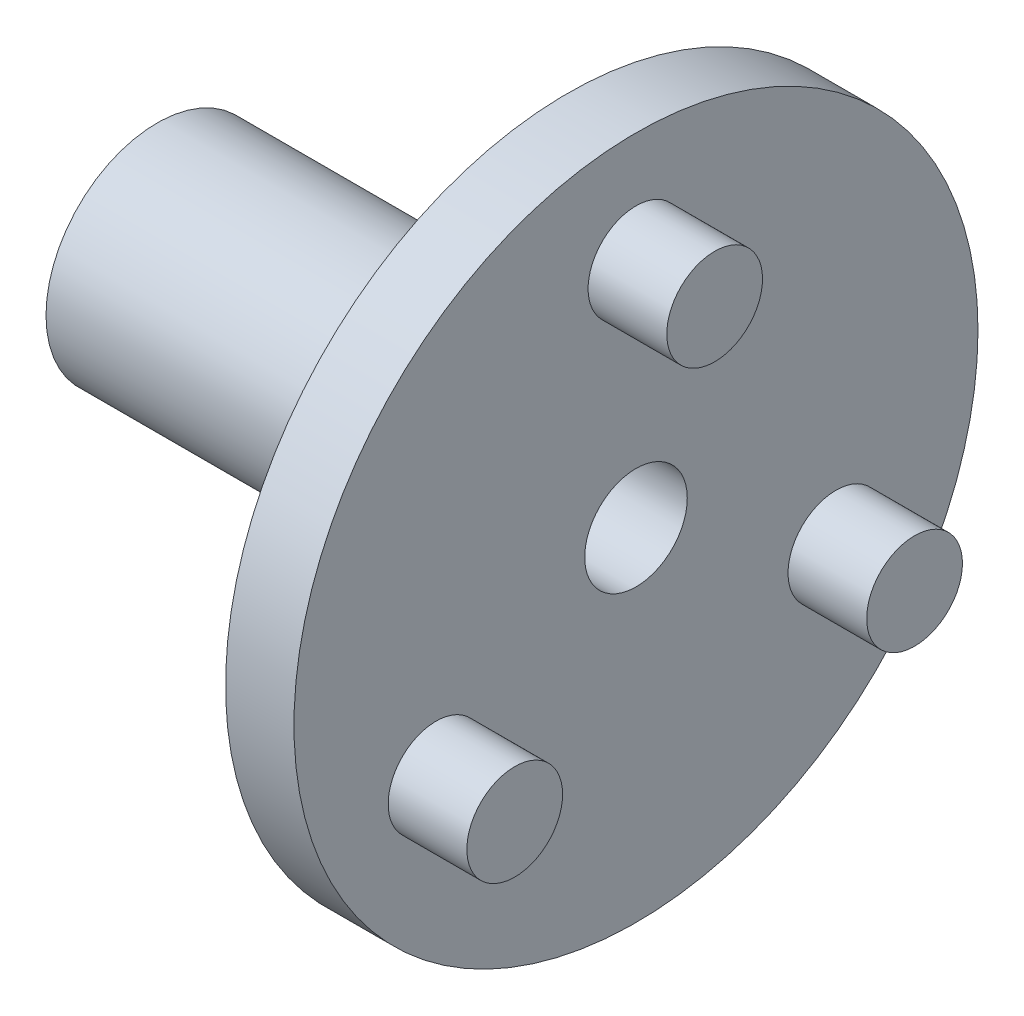
from build123d import *

# Parameters (mm, degrees)
SKETCH_1_R          = 1.4
EXTRUDE_1_DEPTH     = 2.3
EXTRUDE_1_2_DEPTH   = 2.3
EXTRUDE_1_3_DEPTH   = 2.3
SKETCH_2_R          = 10
SKETCH_2_R_2        = 1.5
EXTRUDE_2_DEPTH     = 2
SKETCH_3_R          = 5
SKETCH_3_R_2        = 1.5
EXTRUDE_3_DEPTH     = 4
SKETCH_4_R          = 3.25
SKETCH_4_R_2        = 2.45
EXTRUDE_4_DEPTH     = 8
EXTRUDE_5_DEPTH     = 8
CUT_EXTRUDE_START   = -1
SKETCH_4_6_R        = 5
SKETCH_4_6_R_2      = 3.25
CUT_EXTRUDE_1_DEPTH = 1


with BuildPart() as part:
    # 草图1 → 凸台-拉伸1 (new body)
    with BuildSketch(Plane(origin=(0, 0, 0), x_dir=(0, 0, -1), z_dir=(1, 0, 0))):
        with Locations((0, 6.75)):
            Circle(SKETCH_1_R)
    extrude(amount=EXTRUDE_1_DEPTH)



with BuildPart() as body_2:
    # 草图1 → Extrude 1 2 (new body)
    with BuildSketch(Plane(origin=(0, 0, 0), x_dir=(0, 0, -1), z_dir=(1, 0, 0))):
        with Locations((5.845671476, -3.375)):
            Circle(SKETCH_1_R)
    extrude(amount=EXTRUDE_1_2_DEPTH)


with BuildPart() as body_3:
    # 草图1 → Extrude 1 3 (new body)
    with BuildSketch(Plane(origin=(0, 0, 0), x_dir=(0, 0, -1), z_dir=(1, 0, 0))):
        with Locations((-5.845671476, -3.375)):
            Circle(SKETCH_1_R)
    extrude(amount=EXTRUDE_1_3_DEPTH)


with BuildPart() as part_1:
    add(part.part)

    add(body_2.part)  # 凸台-拉伸2 merges body 2

    add(body_3.part)  # 凸台-拉伸2 merges body 3
    # 草图2 → 凸台-拉伸2 (add)
    with BuildSketch(Plane(origin=(0, 0, 0), x_dir=(0, 0, -1), z_dir=(1, 0, 0))):
        Circle(SKETCH_2_R)
        Circle(SKETCH_2_R_2, mode=Mode.SUBTRACT)
    extrude(amount=-EXTRUDE_2_DEPTH)

    # 草图3 → 凸台-拉伸3 (add)
    with BuildSketch(Plane.ZY.offset(2)):
        with Locations(Location((0, 0, 0), (0, 0, 180))):
            Circle(SKETCH_3_R)
        with Locations(Location((0, 0, 0), (0, 0, 180))):
            Circle(SKETCH_3_R_2, mode=Mode.SUBTRACT)
    extrude(amount=EXTRUDE_3_DEPTH)

    # 草图4 → 凸台-拉伸4 (add)
    with BuildSketch(Plane.ZY.offset(6)):
        Circle(SKETCH_4_R)
        Circle(SKETCH_4_R_2, mode=Mode.SUBTRACT)
    extrude(amount=EXTRUDE_4_DEPTH)

    # 草图4<3> → 凸台-拉伸5 (add)
    with BuildSketch(Plane.ZY.offset(6)):
        with BuildLine():
            Line((2.158689242, -1.158689242), (1.158689242, -1.158689242))
            Line((1.158689242, -1.158689242), (1.158689242, -2.158689242))
            ThreePointArc((1.158689242, -2.158689242), (1.732411614, -1.732411614), (2.158689242, -1.158689242))
        make_face()
        with BuildLine():
            ThreePointArc((2.158689242, 1.158689242), (1.732411614, 1.732411614), (1.158689242, 2.158689242))
            Line((1.158689242, 2.158689242), (1.158689242, 1.158689242))
            Line((1.158689242, 1.158689242), (2.158689242, 1.158689242))
        make_face()
        with BuildLine():
            Line((-1.158689242, 1.158689242), (-1.158689242, 2.158689242))
            ThreePointArc((-1.158689242, 2.158689242), (-1.732411614, 1.732411614), (-2.158689242, 1.158689242))
            Line((-2.158689242, 1.158689242), (-1.158689242, 1.158689242))
        make_face()
        with BuildLine():
            Line((-1.158689242, -2.158689242), (-1.158689242, -1.158689242))
            Line((-1.158689242, -1.158689242), (-2.158689242, -1.158689242))
            ThreePointArc((-2.158689242, -1.158689242), (-1.732411614, -1.732411614), (-1.158689242, -2.158689242))
        make_face()
    extrude(amount=EXTRUDE_5_DEPTH)

    # 草图4<6> → 切除-拉伸1 (cut)
    with BuildSketch(Plane.ZY.offset(6).offset(CUT_EXTRUDE_START)):
        with Locations(Location((0, 0, 0), (0, 0, 180))):
            Circle(SKETCH_4_6_R)
        Circle(SKETCH_4_6_R_2, mode=Mode.SUBTRACT)
    extrude(amount=CUT_EXTRUDE_1_DEPTH, mode=Mode.SUBTRACT)


solid = part_1.part
